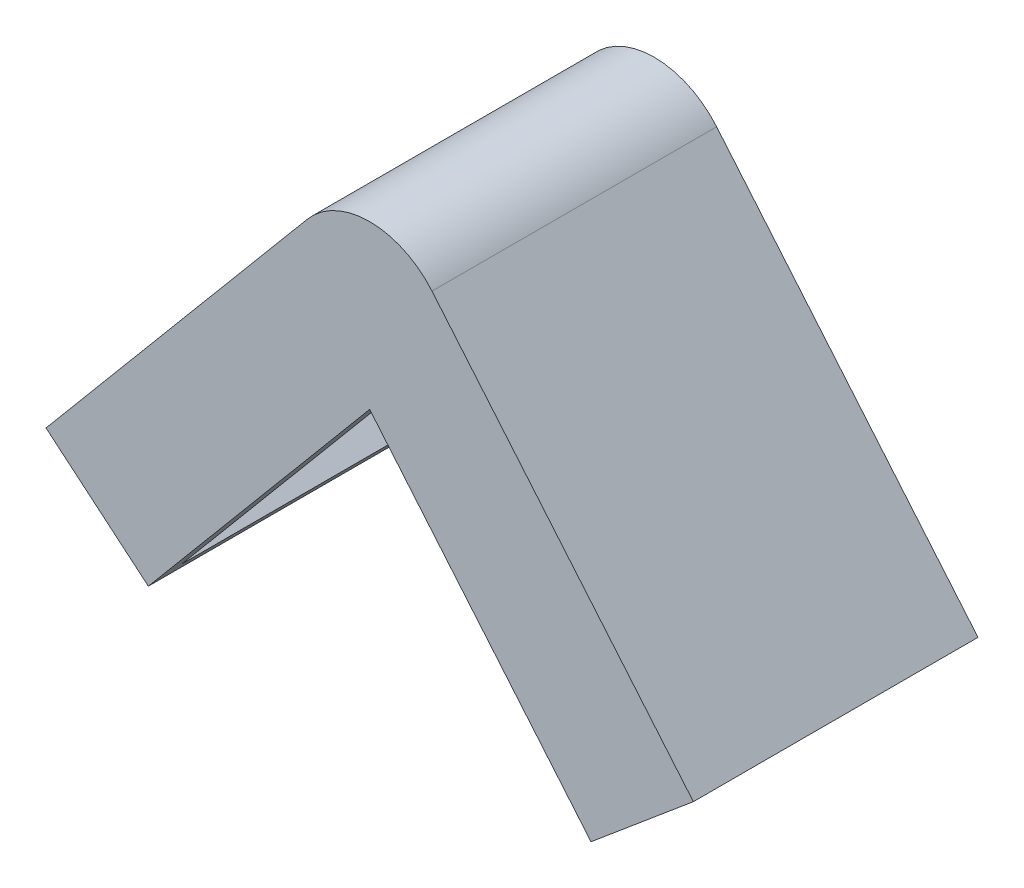
from build123d import *

# Parameters (mm, degrees)
BOSS_EXTRUDE1_DEPTH     = 88.9
CUT_EXTRUDE1_DEPTH      = 3.048
CUT_EXTRUDE1_DEPTH_BACK = 36.576
SKETCH3_W               = 76.2
SKETCH3_H               = 94.842471145


with BuildPart() as part:
    # Sketch1 → Boss-Extrude1 (new body)
    with BuildSketch(Plane.XY):
        with BuildLine():
            ThreePointArc((25.4, 0), (17.960512242, -17.960512242), (0, -25.4))
            Line((0, -25.4), (69.126967967, -107.78231242))
            Line((69.126967967, -107.78231242), (101.091555285, -80.96083899))
            Line((101.091555285, -80.96083899), (19.457528855, 16.326805286))
            ThreePointArc((19.457528855, 16.326805286), (23.868192568, 8.68731164), (25.4, 0))
        make_face()
        with BuildLine():
            ThreePointArc((19.457528855, 16.326805286), (0, 25.4), (-19.457528855, 16.326805286))
            Line((-19.457528855, 16.326805286), (0, 0))
            Line((0, 0), (19.457528855, 16.326805286))
        make_face()
        with BuildLine():
            Line((12.507058463, -10.494668144), (0, -25.4))
            ThreePointArc((0, -25.4), (17.960512242, -17.960512242), (25.4, 0))
            ThreePointArc((25.4, 0), (23.868192568, 8.68731164), (19.457528855, 16.326805286))
            Line((19.457528855, 16.326805286), (0, 0))
            Line((0, 0), (12.507058463, -10.494668144))
        make_face()
        Polygon((-12.507058463, -10.494668144), (0, -25.4), (12.507058463, -10.494668144), (0, 0), align=None)
        with BuildLine():
            ThreePointArc((-19.457528855, 16.326805286), (-23.020217791, -10.734503848), (0, -25.4))
            Line((0, -25.4), (-12.507058463, -10.494668144))
            Line((-12.507058463, -10.494668144), (0, 0))
            Line((0, 0), (-19.457528855, 16.326805286))
        make_face()
        with BuildLine():
            Line((-69.126967967, -107.78231242), (0, -25.4))
            ThreePointArc((0, -25.4), (-23.020217791, -10.734503848), (-19.457528855, 16.326805286))
            Line((-19.457528855, 16.326805286), (-101.091555285, -80.96083899))
            Line((-101.091555285, -80.96083899), (-69.126967967, -107.78231242))
        make_face()
    extrude(amount=BOSS_EXTRUDE1_DEPTH)

    # Sketch3 → Cut-Extrude1 (cut, two sides: drawn at the far end of the back side and taken through both)
    with BuildSketch(Plane(origin=(12.507058463, -10.494668144, 0), x_dir=(0, 0, -1), z_dir=(0.7660444431189793, -0.6427876096865378, 0)).offset(-CUT_EXTRUDE1_DEPTH_BACK)):
        with Locations((-44.45, -73.228764428)):
            Rectangle(SKETCH3_W, SKETCH3_H)
    extrude(amount=CUT_EXTRUDE1_DEPTH + CUT_EXTRUDE1_DEPTH_BACK, mode=Mode.SUBTRACT)


solid = part.part
